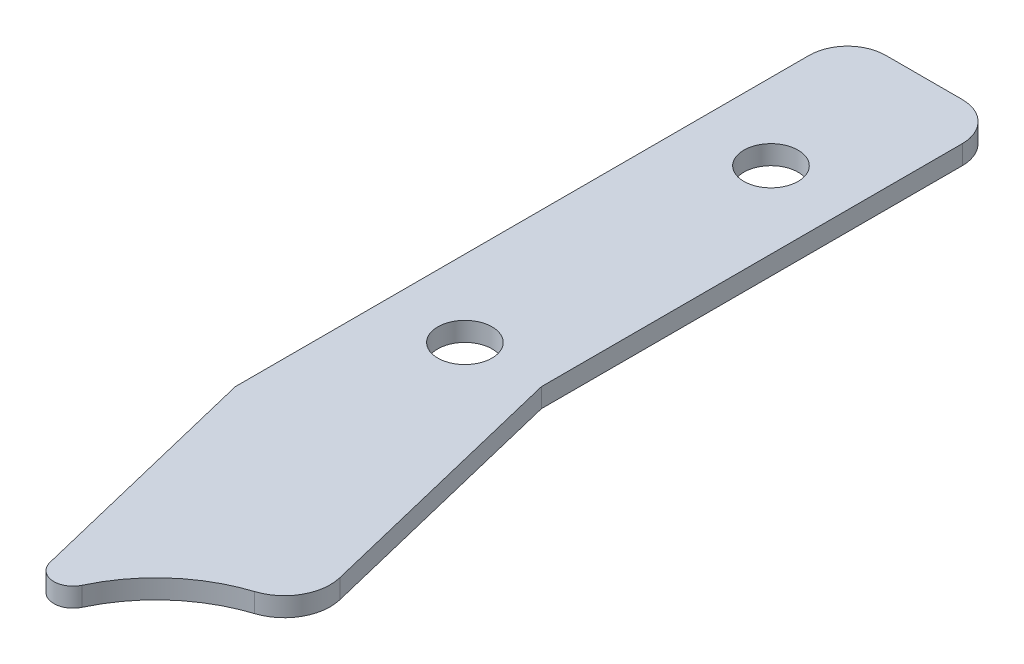
from build123d import *

# Parameters (mm, degrees)
BOSS_EXTRUDE1_DEPTH = 1.5875
FILLET1_R           = 3.81
FILLET2_R           = 1.5875
SKETCH8_R           = 2.25
CUT_EXTRUDE1_DEPTH  = 3.175


with BuildPart() as part:
    # Sketch1 → Boss-Extrude1 (new body)
    with BuildSketch(Plane(origin=(0, 0, 0), x_dir=(1, 0, 0), z_dir=(0, 1, 0))):
        with BuildLine():
            Line((-247.50833587, -59.933994147), (-240.439659658, -89.034683934))
            add(Edge.make_bspline(
                [(-240.439659658, -89.034683934), (-242.558073639, -80.3134883), (-236.877012866, -74.608932784), (-230.317813562, -73.452368974), (-229.725859184, -73.347991446), (-229.113793878, -73.283589588), (-228.485146838, -73.26562397)],
                knots=[0.241984005, 0.241984005, 0.241984005, 0.241984005, 0.5, 0.5, 0.5, 0.533893072, 0.533893072, 0.533893072, 0.533893072], degree=3, weights=[0.500514049, 0.489483356, 0.655978673, 1, 0.954809238, 0.912681783, 0.873617635]))
            Line((-228.485146838, -73.26562397), (-234.80833587, -47.233994147))
            Line((-234.80833587, -47.233994147), (-234.80833587, -12.308994147))
            ThreePointArc((-234.80833587, -12.308994147), (-235.738271839, -10.063930117), (-237.98333587, -9.133994147))
            Line((-237.98333587, -9.133994147), (-244.33333587, -9.133994147))
            ThreePointArc((-244.33333587, -9.133994147), (-246.5783999, -10.063930117), (-247.50833587, -12.308994147))
            Line((-247.50833587, -12.308994147), (-247.50833587, -59.933994147))
        make_face()
    extrude(amount=BOSS_EXTRUDE1_DEPTH)

    # Fillet1
    fillet1_edges = [part.edges().sort_by_distance(p)[0] for p in [
        (-228.485146838, 0.79375, 73.26562397),
    ]]
    fillet(fillet1_edges, radius=FILLET1_R)

    # Fillet2
    fillet2_edges = [part.edges().sort_by_distance(p)[0] for p in [
        (-240.439659658, 0.79375, 89.034683934),
    ]]
    fillet(fillet2_edges, radius=FILLET2_R)

    # Sketch8 → Cut-Extrude1 (cut)
    with BuildSketch(Plane(origin=(0, 1.5875, 0), x_dir=(1, 0, 0), z_dir=(0, 1, 0))):
        with Locations(Location((-241.15833587, -21.833994147, 0), (0, 0, 270))):
            Circle(SKETCH8_R)
        with Locations(Location((-241.15833587, -47.233994147, 0), (0, 0, 270))):
            Circle(SKETCH8_R)
    extrude(amount=-CUT_EXTRUDE1_DEPTH, mode=Mode.SUBTRACT)


solid = part.part
